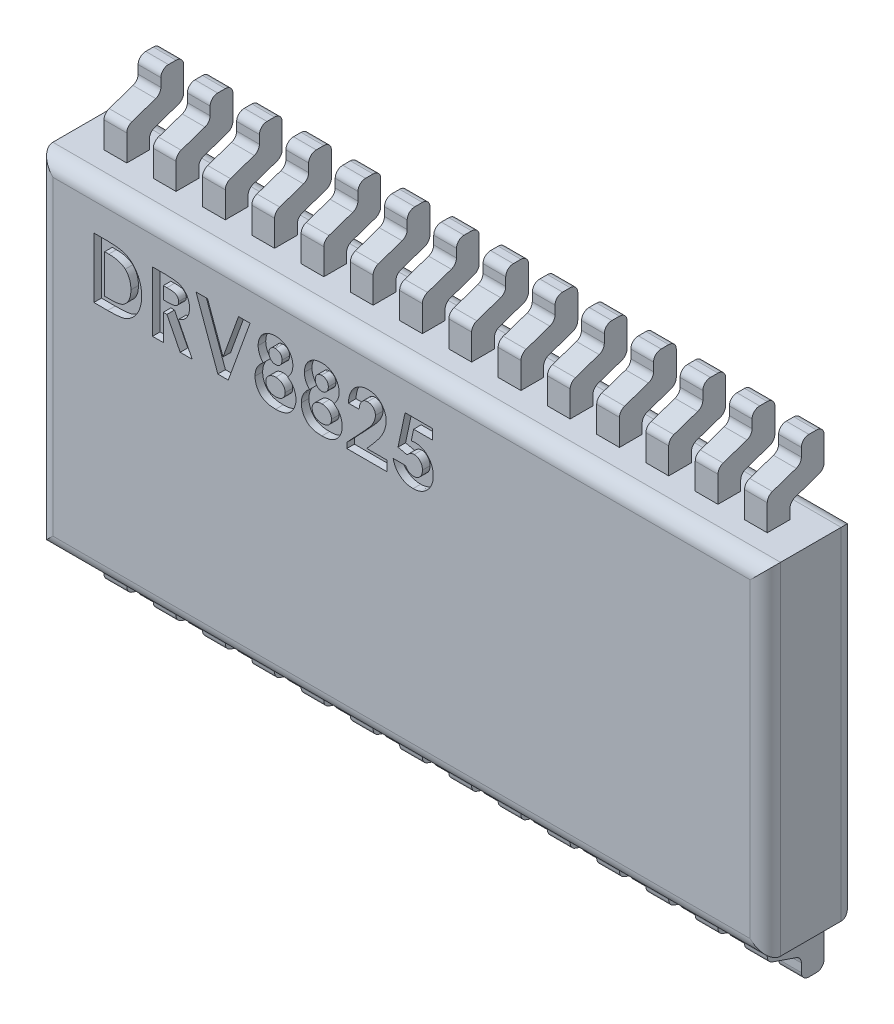
from build123d import *

# Parameters (mm, degrees)
SKETCH1_W           = 9.6
SKETCH1_H           = 4.5
BOSS_EXTRUDE1_DEPTH = 1.2
BOSS_EXTRUDE2_DEPTH = 0.3
LPATTERN1_COUNT     = 8
LPATTERN1_PITCH     = 0.65
LPATTERN1_COL_COUNT = 7
LPATTERN1_COL_PITCH = 0.65
FILLET1_R           = 0.2
CUT_EXTRUDE1_DEPTH  = 0.1


with BuildPart() as part:
    # Sketch1 → Boss-Extrude1 (new body)
    with BuildSketch(Plane.XY):
        Rectangle(SKETCH1_W, SKETCH1_H)
    extrude(amount=BOSS_EXTRUDE1_DEPTH)

    # Sketch2 → Boss-Extrude2 (add)
    with BuildSketch(Plane(origin=(0.175, 0, 0), x_dir=(0, 0, -1), z_dir=(1, 0, 0))):
        with BuildLine():
            Line((-0.75, 2.25), (-0.75, 2.593130895))
            ThreePointArc((-0.75, 2.593130895), (-0.731320668, 2.651328395), (-0.68226102, 2.687784086))
            Line((-0.68226102, 2.687784086), (-0.36773898, 2.794983873))
            ThreePointArc((-0.36773898, 2.794983873), (-0.318679332, 2.831439564), (-0.3, 2.889637064))
            Line((-0.3, 2.889637064), (-0.3, 3))
            ThreePointArc((-0.3, 3), (-0.270710678, 3.070710678), (-0.2, 3.1))
            Line((-0.2, 3.1), (-0.1, 3.1))
            ThreePointArc((-0.1, 3.1), (-0.029289322, 3.070710678), (0, 3))
            Line((0, 3), (0, 2.674940721))
            ThreePointArc((0, 2.674940721), (-0.018679332, 2.616743221), (-0.06773898, 2.58028753))
            Line((-0.06773898, 2.58028753), (-0.38226102, 2.473087743))
            ThreePointArc((-0.38226102, 2.473087743), (-0.431320668, 2.436632052), (-0.45, 2.378434552))
            Line((-0.45, 2.378434552), (-0.45, 2.25))
            Line((-0.45, 2.25), (-0.75, 2.25))
        make_face()
        with BuildLine():
            Line((-0.45, -2.25), (-0.75, -2.25))
            Line((-0.75, -2.25), (-0.75, -2.593130895))
            ThreePointArc((-0.75, -2.593130895), (-0.731320668, -2.651328395), (-0.68226102, -2.687784086))
            Line((-0.68226102, -2.687784086), (-0.36773898, -2.794983873))
            ThreePointArc((-0.36773898, -2.794983873), (-0.318679332, -2.831439564), (-0.3, -2.889637064))
            Line((-0.3, -2.889637064), (-0.3, -3))
            ThreePointArc((-0.3, -3), (-0.270710678, -3.070710678), (-0.2, -3.1))
            Line((-0.2, -3.1), (-0.1, -3.1))
            ThreePointArc((-0.1, -3.1), (-0.029289322, -3.070710678), (0, -3))
            Line((0, -3), (0, -2.674940721))
            ThreePointArc((0, -2.674940721), (-0.018679332, -2.616743221), (-0.06773898, -2.58028753))
            Line((-0.06773898, -2.58028753), (-0.38226102, -2.473087743))
            ThreePointArc((-0.38226102, -2.473087743), (-0.431320668, -2.436632052), (-0.45, -2.378434552))
            Line((-0.45, -2.378434552), (-0.45, -2.25))
        make_face()
    boss_extrude2 = extrude(amount=BOSS_EXTRUDE2_DEPTH)

    # LPattern1: Boss-Extrude2 ×8
    with Locations(*[(-i * LPATTERN1_PITCH, 0, 0) for i in range(1, LPATTERN1_COUNT)]):
        add(boss_extrude2)

    # LPattern1 col: Boss-Extrude2 ×7
    with Locations(*[(i * LPATTERN1_COL_PITCH, 0, 0) for i in range(1, LPATTERN1_COL_COUNT)]):
        add(boss_extrude2)

    # Fillet1
    fillet1_edges = [part.edges().sort_by_distance(p)[0] for p in [
        (-4.8, 0, 1.2),
        (0, -2.25, 1.2),
        (4.8, 0, 1.2),
        (0, -2.25, 0),
        (-4.8, 0, 0),
        (0, 2.25, 0),
        (4.8, 0, 0),
        (0, 2.25, 1.2),
    ]]
    fillet(fillet1_edges, radius=FILLET1_R)

    # Sketch3 → Cut-Extrude1 (cut)
    # profile 1 of 7: a face of its own
    with BuildSketch(Plane.XY.offset(1.2)):
        with BuildLine():
            Line((-4.059080057, 1.683178556), (-3.879564082, 1.683178556))
            add(Edge.make_bspline(
                [(-3.879564082, 1.683178556), (-3.865568747, 1.683080724), (-3.838515606, 1.682891613), (-3.799320956, 1.68076079), (-3.76287492, 1.677483736), (-3.729154003, 1.672975554), (-3.698227339, 1.667009994), (-3.670134806, 1.659527369), (-3.64478212, 1.650889922), (-3.621891294, 1.640726214), (-3.600994171, 1.62887634), (-3.581151686, 1.615676531), (-3.562402799, 1.600643241), (-3.544484399, 1.58406649), (-3.527627727, 1.565643014), (-3.511552059, 1.54567797), (-3.496651, 1.523881839), (-3.482474123, 1.500777224), (-3.469653024, 1.476266208), (-3.458469983, 1.450557424), (-3.449101881, 1.423816319), (-3.441489814, 1.396014393), (-3.435422117, 1.367243939), (-3.431176672, 1.337446903), (-3.428552096, 1.306650871), (-3.428285855, 1.285778888), (-3.42815057, 1.275173248)],
                knots=[0, 0, 0, 0, 1.44355588, 2.790409838, 4.047694926, 5.217575253, 6.298404546, 7.294384826, 8.214239204, 9.058592145, 9.873746385, 10.689560431, 11.514393297, 12.350027578, 13.205127629, 14.088021785, 14.991911688, 15.926770944, 16.882954281, 17.842803888, 18.816321264, 19.80318086, 20.814351908, 21.847355356, 22.906180909, 24, 24, 24, 24], degree=3))
            add(Edge.make_bspline(
                [(-3.42815057, 1.275173248), (-3.428504818, 1.260208), (-3.429202177, 1.230748033), (-3.435076336, 1.187515871), (-3.44457684, 1.146073532), (-3.457935412, 1.106745193), (-3.474496465, 1.069881081), (-3.494280497, 1.036131277), (-3.516997428, 1.005676933), (-3.542382605, 0.978669688), (-3.56986857, 0.955456594), (-3.598432029, 0.935576278), (-3.628351244, 0.919898991), (-3.654714254, 0.909957246), (-3.677574272, 0.90377434), (-3.697645121, 0.900120184), (-3.720443557, 0.896769102), (-3.746182156, 0.894179458), (-3.774748009, 0.891870132), (-3.80625498, 0.890615334), (-3.840601057, 0.889572783), (-3.864457655, 0.889477892), (-3.876861007, 0.889428556)],
                knots=[0, 0, 0, 0, 1.315458931, 2.589557908, 3.828601765, 5.048913369, 6.235739168, 7.376350998, 8.481830359, 9.569842114, 10.627874879, 11.640079404, 12.624025415, 13.590060155, 14.111227486, 14.704434459, 15.382649715, 16.137166398, 16.978595427, 17.902333227, 18.909396075, 20, 20, 20, 20], degree=3))
            Line((-3.876861007, 0.889428556), (-4.059080057, 0.889428556))
            Line((-4.059080057, 0.889428556), (-4.059080057, 1.683178556))
        make_face()
        with BuildLine():
            Line((-3.916612108, 1.540710607), (-3.916612108, 1.031896505))
            Line((-3.916612108, 1.031896505), (-3.842198046, 1.031896505))
            add(Edge.make_bspline(
                [(-3.842198046, 1.031896505), (-3.833343915, 1.031912729), (-3.816314475, 1.031943934), (-3.791727817, 1.033430255), (-3.768991393, 1.034922111), (-3.74816779, 1.037753703), (-3.729105461, 1.040907897), (-3.712066273, 1.045297391), (-3.696698973, 1.049908182), (-3.68319127, 1.05577829), (-3.670819315, 1.062385488), (-3.659364298, 1.070126587), (-3.648306999, 1.078722784), (-3.637854143, 1.088426908), (-3.62796617, 1.099110456), (-3.618701582, 1.110828477), (-3.609936722, 1.123545219), (-3.601896568, 1.137327918), (-3.594549431, 1.152031025), (-3.588031698, 1.16751212), (-3.582627535, 1.183900127), (-3.578135926, 1.201041634), (-3.574926162, 1.219085878), (-3.572270694, 1.237899208), (-3.570901723, 1.25755616), (-3.570713841, 1.270931406), (-3.570618519, 1.277717318)],
                knots=[0, 0, 0, 0, 1.50275155, 2.890291501, 4.180787663, 5.369391935, 6.45668281, 7.458360028, 8.354766181, 9.177074746, 9.954075863, 10.732690366, 11.5210699, 12.329727389, 13.151100085, 13.990027547, 14.863562427, 15.770965086, 16.696477834, 17.652329173, 18.619756807, 19.62365428, 20.657822005, 21.729286259, 22.847956731, 24, 24, 24, 24], degree=3))
            add(Edge.make_bspline(
                [(-3.570618519, 1.277717318), (-3.570808368, 1.288116087), (-3.571178559, 1.308392879), (-3.574748601, 1.33792647), (-3.580559949, 1.36573677), (-3.588852183, 1.391720568), (-3.5993048, 1.415950892), (-3.612388688, 1.43822246), (-3.627540765, 1.458909403), (-3.639522614, 1.471045027), (-3.645509594, 1.477108845)],
                knots=[0, 0, 0, 0, 1.13821349, 2.219428113, 3.251817212, 4.244760574, 5.201143372, 6.134805572, 7.068016741, 8, 8, 8, 8], degree=3))
            add(Edge.make_bspline(
                [(-3.645509594, 1.477108845), (-3.651413324, 1.482276037), (-3.663471024, 1.492829442), (-3.684640382, 1.505475121), (-3.707967918, 1.516585589), (-3.733987296, 1.525394951), (-3.762447051, 1.53236177), (-3.793516689, 1.537166615), (-3.827029826, 1.540254157), (-3.850246946, 1.540555198), (-3.862232601, 1.540710607)],
                knots=[0, 0, 0, 0, 0.813307809, 1.661089106, 2.549956539, 3.493439533, 4.508053171, 5.589449661, 6.755572447, 8, 8, 8, 8], degree=3))
            Line((-3.862232601, 1.540710607), (-3.916612108, 1.540710607))
        make_face(mode=Mode.SUBTRACT)
    # profile 2 of 7: a face of its own
    with BuildSketch(Plane.XY.offset(1.2)):
        with BuildLine():
            Line((-3.285682621, 1.683178556), (-3.11968202, 1.683178556))
            add(Edge.make_bspline(
                [(-3.11968202, 1.683178556), (-3.108709431, 1.68313961), (-3.087606051, 1.683064705), (-3.05717613, 1.681882904), (-3.029222063, 1.680238332), (-3.003702461, 1.67772867), (-2.980628242, 1.674401162), (-2.95997628, 1.670478581), (-2.941747179, 1.666007959), (-2.925787201, 1.660437211), (-2.911384111, 1.654153492), (-2.897958428, 1.646933383), (-2.885213962, 1.638857283), (-2.873235897, 1.629712688), (-2.86192014, 1.619664107), (-2.851245342, 1.608701424), (-2.84136235, 1.596731682), (-2.832332359, 1.583830513), (-2.824102248, 1.570258779), (-2.816828557, 1.555997846), (-2.810913579, 1.541037796), (-2.805687062, 1.525594835), (-2.801922571, 1.509448202), (-2.799304422, 1.492755088), (-2.797387517, 1.47545673), (-2.797277304, 1.463704994), (-2.797221083, 1.457710307)],
                knots=[0, 0, 0, 0, 1.749336639, 3.364467119, 4.854658419, 6.213483162, 7.451590619, 8.570285859, 9.5643256, 10.440900261, 11.26203566, 12.067320669, 12.869050712, 13.665104639, 14.467235401, 15.27997916, 16.102287765, 16.939272006, 17.78853747, 18.631303466, 19.488103222, 20.351255419, 21.228522269, 22.127379805, 23.044756219, 24, 24, 24, 24], degree=3))
            add(Edge.make_bspline(
                [(-2.797221083, 1.457710307), (-2.797367124, 1.451453231), (-2.797653485, 1.439184244), (-2.799195979, 1.421162103), (-2.802015173, 1.40391978), (-2.806285254, 1.387507756), (-2.811193156, 1.371721767), (-2.817719408, 1.356853073), (-2.825084928, 1.34268543), (-2.833832741, 1.329419245), (-2.843433038, 1.31675985), (-2.854597982, 1.305192273), (-2.866604255, 1.294094801), (-2.880126775, 1.284162541), (-2.894569455, 1.27472391), (-2.910219257, 1.266169998), (-2.926974045, 1.258285777), (-2.93875349, 1.25388899), (-2.944777173, 1.251640595)],
                knots=[0, 0, 0, 0, 1.099860209, 2.156625411, 3.176576793, 4.16617041, 5.135385252, 6.078461593, 7.016046972, 7.938469504, 8.868247731, 9.803980173, 10.76021508, 11.73834243, 12.748633912, 13.790971185, 14.870363756, 16, 16, 16, 16], degree=3))
            Line((-2.944777173, 1.251640595), (-2.761604096, 0.889428556))
            Line((-2.761604096, 0.889428556), (-2.919972485, 0.889428556))
            Line((-2.919972485, 0.889428556), (-3.094877333, 1.235422146))
            Line((-3.094877333, 1.235422146), (-3.143214673, 1.235422146))
            Line((-3.143214673, 1.235422146), (-3.143214673, 0.889428556))
            Line((-3.143214673, 0.889428556), (-3.285682621, 0.889428556))
            Line((-3.285682621, 0.889428556), (-3.285682621, 1.683178556))
        make_face()
        with BuildLine():
            Line((-3.143214673, 1.377890095), (-3.087722135, 1.377890095))
            add(Edge.make_bspline(
                [(-3.087722135, 1.377890095), (-3.08093771, 1.377966505), (-3.067946996, 1.378112816), (-3.049264643, 1.378791463), (-3.03229661, 1.380426667), (-3.016970033, 1.382492686), (-3.003207787, 1.384878204), (-2.991132629, 1.388296796), (-2.980558498, 1.391959904), (-2.971610698, 1.396512197), (-2.963965904, 1.401689141), (-2.957365113, 1.407570279), (-2.951905312, 1.414376946), (-2.947411618, 1.421924168), (-2.943916012, 1.430278698), (-2.941364488, 1.439348822), (-2.939938563, 1.44923786), (-2.939774506, 1.456062642), (-2.939689032, 1.45961836)],
                knots=[0, 0, 0, 0, 1.688639943, 3.233382647, 4.650958383, 5.928841754, 7.082724185, 8.122798841, 9.049171256, 9.863274652, 10.613301712, 11.341792392, 12.054588806, 12.776240173, 13.521029143, 14.301969904, 15.115324896, 16, 16, 16, 16], degree=3))
            add(Edge.make_bspline(
                [(-2.939689032, 1.45961836), (-2.939850628, 1.463825033), (-2.940168055, 1.472088264), (-2.943317913, 1.483984418), (-2.948331806, 1.494995123), (-2.955204481, 1.505070629), (-2.963859721, 1.513903513), (-2.973792292, 1.521689771), (-2.985216563, 1.527846561), (-2.995794578, 1.531907514), (-3.005418099, 1.534337224), (-3.014103023, 1.536147822), (-3.024160218, 1.537431046), (-3.035597275, 1.538792132), (-3.048385042, 1.539674728), (-3.06259322, 1.540318847), (-3.078181002, 1.540582388), (-3.089047167, 1.540666637), (-3.094718328, 1.540710607)],
                knots=[0, 0, 0, 0, 1.020303359, 2.004196876, 2.966617323, 3.9489082, 4.950758222, 5.960522915, 7.003732012, 8.091992268, 8.70421221, 9.413913587, 10.24622431, 11.166358409, 12.212345909, 13.359657661, 14.621978493, 16, 16, 16, 16], degree=3))
            Line((-3.094718328, 1.540710607), (-3.143214673, 1.540710607))
            Line((-3.143214673, 1.540710607), (-3.143214673, 1.377890095))
        make_face(mode=Mode.SUBTRACT)
    # profile 3 of 7: a face of its own
    with BuildSketch(Plane.XY.offset(1.2)):
        Polygon((-2.710722685, 1.683178556), (-2.558555468, 1.683178556), (-2.354552814, 1.119348929), (-2.150073146, 1.683178556), (-1.998382942, 1.683178556), (-2.286180919, 0.889428556), (-2.423401722, 0.889428556), align=None)
    # profile 4 of 7: a face of its own
    with BuildSketch(Plane.XY.offset(1.2)):
        with BuildLine():
            add(Edge.make_bspline(
                [(-1.501653174, 1.316832402), (-1.493329706, 1.310885059), (-1.476854151, 1.29911283), (-1.455095969, 1.278022441), (-1.43635459, 1.254495868), (-1.420826816, 1.228677418), (-1.408386433, 1.201201714), (-1.399481006, 1.17236244), (-1.393824381, 1.142413965), (-1.393206508, 1.122024208), (-1.39289416, 1.111716717)],
                knots=[0, 0, 0, 0, 1.013736912, 2.006600758, 2.994453809, 3.989973287, 4.987781207, 5.978959008, 6.978317308, 8, 8, 8, 8], degree=3))
            add(Edge.make_bspline(
                [(-1.39289416, 1.111716717), (-1.393270985, 1.100555519), (-1.394018368, 1.078418714), (-1.40062624, 1.045955093), (-1.411234913, 1.014766916), (-1.425733734, 0.985198421), (-1.443912589, 0.958168485), (-1.465101736, 0.934239288), (-1.489327885, 0.914035783), (-1.511883115, 0.900327835), (-1.53129719, 0.891221904), (-1.546964179, 0.885394291), (-1.563507488, 0.880263894), (-1.58104517, 0.876165046), (-1.599574035, 0.872965223), (-1.61906764, 0.870852066), (-1.639538818, 0.86931593), (-1.653499296, 0.86915732), (-1.660657581, 0.869075992)],
                knots=[0, 0, 0, 0, 1.313679292, 2.605514271, 3.884962679, 5.186178731, 6.472827995, 7.711026938, 8.938935107, 10.174644318, 10.808706728, 11.462743532, 12.142127587, 12.847854939, 13.582806024, 14.355735269, 15.156897313, 16, 16, 16, 16], degree=3))
            add(Edge.make_bspline(
                [(-1.660657581, 0.869075992), (-1.668291183, 0.869179539), (-1.683198101, 0.869381745), (-1.704958881, 0.870604388), (-1.725485725, 0.87285847), (-1.744821692, 0.875825793), (-1.762948178, 0.879752422), (-1.779865721, 0.884731173), (-1.795615169, 0.890400034), (-1.814893321, 0.899031362), (-1.836924753, 0.912511029), (-1.860736746, 0.932251613), (-1.881637584, 0.955763265), (-1.899808883, 0.982386017), (-1.914132186, 1.011956085), (-1.924783421, 1.043545362), (-1.931091209, 1.077068244), (-1.931850596, 1.10002977), (-1.932237108, 1.111716717)],
                knots=[0, 0, 0, 0, 0.886964665, 1.7320671, 2.531131818, 3.285397207, 4.004107883, 4.684213108, 5.332925796, 5.947568694, 7.135706876, 8.320776993, 9.52873045, 10.778999824, 12.05415135, 13.333578234, 14.642845846, 16, 16, 16, 16], degree=3))
            add(Edge.make_bspline(
                [(-1.932237108, 1.111716717), (-1.931883901, 1.121911656), (-1.931189805, 1.141945945), (-1.926217903, 1.171302515), (-1.917692602, 1.199136017), (-1.905994562, 1.225640216), (-1.890910138, 1.250818062), (-1.87235013, 1.274484295), (-1.85054986, 1.296852417), (-1.834018307, 1.310061936), (-1.825545151, 1.316832402)],
                knots=[0, 0, 0, 0, 1.01821053, 2.000906977, 2.963938143, 3.919209931, 4.888045165, 5.887808425, 6.917407893, 8, 8, 8, 8], degree=3))
            add(Edge.make_bspline(
                [(-1.825545151, 1.316832402), (-1.830798059, 1.322890862), (-1.841139451, 1.334818145), (-1.854521314, 1.354014156), (-1.86579497, 1.373805264), (-1.875366841, 1.394030853), (-1.882442612, 1.415039158), (-1.887793526, 1.436499884), (-1.890819998, 1.458631667), (-1.891293045, 1.473549147), (-1.89153198, 1.481083955)],
                knots=[0, 0, 0, 0, 1.061529281, 2.089831458, 3.092927091, 4.075998741, 5.048384512, 6.024008542, 7.00192825, 8, 8, 8, 8], degree=3))
            add(Edge.make_bspline(
                [(-1.89153198, 1.481083955), (-1.891215188, 1.491283863), (-1.890590169, 1.511407889), (-1.885054415, 1.540833965), (-1.875863719, 1.568794603), (-1.863360559, 1.595207938), (-1.847483489, 1.619498318), (-1.828618093, 1.64128136), (-1.806499159, 1.659759158), (-1.781949233, 1.675613924), (-1.754845257, 1.688224658), (-1.725444393, 1.697048705), (-1.694101658, 1.702634792), (-1.672501182, 1.703227799), (-1.661452603, 1.70353112)],
                knots=[0, 0, 0, 0, 1.022455555, 2.017265428, 2.990720743, 3.968117071, 4.939886797, 5.893155559, 6.847550415, 7.820889576, 8.817530429, 9.83499769, 10.892607882, 12, 12, 12, 12], degree=3))
            add(Edge.make_bspline(
                [(-1.661452603, 1.70353112), (-1.650563153, 1.703227303), (-1.629331006, 1.702634922), (-1.598539078, 1.697085848), (-1.569773572, 1.688065244), (-1.543272357, 1.675188241), (-1.518976324, 1.659302916), (-1.497233319, 1.640181739), (-1.478427123, 1.617856155), (-1.462418263, 1.59293739), (-1.449661661, 1.56609103), (-1.440230751, 1.537937049), (-1.434775801, 1.508696739), (-1.433993027, 1.488843948), (-1.433599288, 1.478857893)],
                knots=[0, 0, 0, 0, 1.094655142, 2.134348324, 3.136019022, 4.118575226, 5.088726318, 6.048298823, 7.020513804, 8.015920439, 9.020015034, 10.003048569, 10.995523219, 12, 12, 12, 12], degree=3))
            add(Edge.make_bspline(
                [(-1.433599288, 1.478857893), (-1.433788962, 1.471800289), (-1.434161182, 1.457950269), (-1.436913305, 1.437545281), (-1.441547543, 1.417966668), (-1.44800872, 1.398741295), (-1.456991962, 1.379346701), (-1.469148376, 1.35941125), (-1.483935058, 1.338106622), (-1.495547778, 1.324163178), (-1.501653174, 1.316832402)],
                knots=[0, 0, 0, 0, 0.940746401, 1.846144481, 2.739104268, 3.619506754, 4.545839139, 5.581956076, 6.728711598, 8, 8, 8, 8], degree=3))
        make_face()
        with BuildLine():
            add(Edge.make_bspline(
                [(-1.6649507, 1.561063172), (-1.670816403, 1.56078039), (-1.682226491, 1.560230319), (-1.698507351, 1.555265311), (-1.713144375, 1.547144688), (-1.725803445, 1.535969113), (-1.736184542, 1.522409226), (-1.743814078, 1.506819365), (-1.748338483, 1.489391927), (-1.748817479, 1.477188905), (-1.749064032, 1.470907673)],
                knots=[0, 0, 0, 0, 1.018099191, 1.980427864, 2.929421084, 3.909248076, 4.895556904, 5.880788387, 6.909183412, 8, 8, 8, 8], degree=3))
            add(Edge.make_bspline(
                [(-1.749064032, 1.470907673), (-1.748759464, 1.464572798), (-1.748164766, 1.452203344), (-1.743488134, 1.434441068), (-1.735516686, 1.418343395), (-1.724571943, 1.404246552), (-1.711272307, 1.392732658), (-1.696380791, 1.383938987), (-1.679732247, 1.378918908), (-1.668163106, 1.378238168), (-1.662247625, 1.377890095)],
                knots=[0, 0, 0, 0, 1.07118507, 2.091592095, 3.082435519, 4.092579768, 5.090825648, 6.043203473, 6.999459622, 8, 8, 8, 8], degree=3))
            add(Edge.make_bspline(
                [(-1.662247625, 1.377890095), (-1.656220309, 1.378159792), (-1.644477967, 1.378685212), (-1.627787853, 1.383835548), (-1.612752194, 1.392072461), (-1.599876373, 1.403717633), (-1.589211238, 1.417819581), (-1.581444066, 1.434198575), (-1.576973563, 1.452546875), (-1.576376735, 1.465370653), (-1.576067237, 1.472020704)],
                knots=[0, 0, 0, 0, 1.008803858, 1.965339183, 2.900766489, 3.864508618, 4.855158575, 5.849593072, 6.884859315, 8, 8, 8, 8], degree=3))
            add(Edge.make_bspline(
                [(-1.576067237, 1.472020704), (-1.576384564, 1.478297783), (-1.576998264, 1.490437434), (-1.581398727, 1.507866003), (-1.589480396, 1.523212543), (-1.600098668, 1.536688226), (-1.613411135, 1.547555525), (-1.628865934, 1.555547403), (-1.646349262, 1.56018277), (-1.658615949, 1.560763349), (-1.6649507, 1.561063172)],
                knots=[0, 0, 0, 0, 1.065910571, 2.061433587, 3.023559535, 3.990682701, 4.956464619, 5.918590567, 6.925120432, 8, 8, 8, 8], degree=3))
        make_face(mode=Mode.SUBTRACT)
        with BuildLine():
            add(Edge.make_bspline(
                [(-1.660339572, 1.235422146), (-1.664797063, 1.235348123), (-1.67358272, 1.235202224), (-1.686498359, 1.23351979), (-1.698892241, 1.231012548), (-1.710748991, 1.227553879), (-1.722008709, 1.222838842), (-1.73276684, 1.217154777), (-1.742986229, 1.210444227), (-1.752515296, 1.202829021), (-1.761127346, 1.194470606), (-1.768890325, 1.185753051), (-1.775235464, 1.176450983), (-1.780519453, 1.166873605), (-1.784765168, 1.156945022), (-1.787571906, 1.14650173), (-1.789379052, 1.135682806), (-1.789638359, 1.128313393), (-1.78976916, 1.124596074)],
                knots=[0, 0, 0, 0, 1.129580664, 2.226389355, 3.296443603, 4.333934503, 5.352185725, 6.386189251, 7.41493955, 8.447544828, 9.47401038, 10.455044306, 11.4018853, 12.322125673, 13.225630306, 14.132028716, 15.057747923, 16, 16, 16, 16], degree=3))
            add(Edge.make_bspline(
                [(-1.78976916, 1.124596074), (-1.789706818, 1.120719278), (-1.78958317, 1.113030132), (-1.787715646, 1.101807203), (-1.785026741, 1.090983458), (-1.781250088, 1.080660215), (-1.776199532, 1.070843484), (-1.770169076, 1.061437824), (-1.762948442, 1.052509191), (-1.754733413, 1.044105455), (-1.745536725, 1.036523785), (-1.735624711, 1.029844202), (-1.725128286, 1.02395514), (-1.713732354, 1.019713604), (-1.701858953, 1.015831378), (-1.68918999, 1.013476124), (-1.675863839, 1.011743064), (-1.666759055, 1.011611453), (-1.662088621, 1.011543941)],
                knots=[0, 0, 0, 0, 0.973817353, 1.931446211, 2.852767904, 3.776304432, 4.688323523, 5.623710549, 6.581246645, 7.570897993, 8.57436511, 9.572506873, 10.574556662, 11.591826551, 12.624694332, 13.712108235, 14.826391851, 16, 16, 16, 16], degree=3))
            add(Edge.make_bspline(
                [(-1.662088621, 1.011543941), (-1.657367506, 1.011629517), (-1.64816755, 1.011796277), (-1.634719063, 1.013270121), (-1.621999181, 1.015608682), (-1.610023097, 1.018953369), (-1.598745524, 1.023238047), (-1.588317741, 1.028691594), (-1.578501663, 1.03487198), (-1.569612733, 1.04209252), (-1.561496483, 1.049961401), (-1.554503195, 1.058585025), (-1.54855688, 1.067686088), (-1.543760528, 1.077362927), (-1.539890304, 1.087569863), (-1.537235572, 1.09840867), (-1.535588216, 1.109757546), (-1.535438287, 1.117488118), (-1.535362108, 1.121415986)],
                knots=[0, 0, 0, 0, 1.200705402, 2.339794563, 3.437264955, 4.487414319, 5.499029866, 6.500076882, 7.476298407, 8.444948224, 9.407950986, 10.347155707, 11.263432813, 12.167927724, 13.089546445, 14.03463663, 15.00140776, 16, 16, 16, 16], degree=3))
            add(Edge.make_bspline(
                [(-1.535362108, 1.121415986), (-1.535507564, 1.125395206), (-1.53579188, 1.133173202), (-1.537347612, 1.144659242), (-1.540266007, 1.155548187), (-1.544084121, 1.166092581), (-1.549163089, 1.176074222), (-1.555468517, 1.185472047), (-1.562645642, 1.194518849), (-1.571034116, 1.202811899), (-1.580205607, 1.210394694), (-1.589967198, 1.217150132), (-1.600288822, 1.222871365), (-1.611198711, 1.227548188), (-1.622736728, 1.231014348), (-1.634814837, 1.233519702), (-1.647413225, 1.2352026), (-1.655987931, 1.235348236), (-1.660339572, 1.235422146)],
                knots=[0, 0, 0, 0, 1.011708178, 1.977538892, 2.938094892, 3.871441737, 4.823268678, 5.775953079, 6.743660653, 7.753304209, 8.767430709, 9.76505158, 10.765940967, 11.761741361, 12.775867861, 13.822051386, 14.89469657, 16, 16, 16, 16], degree=3))
        make_face(mode=Mode.SUBTRACT)
    # profile 5 of 7: a face of its own
    with BuildSketch(Plane.XY.offset(1.2)):
        with BuildLine():
            add(Edge.make_bspline(
                [(-0.891076251, 1.316832402), (-0.882752783, 1.310885059), (-0.866277228, 1.29911283), (-0.844519046, 1.278022441), (-0.825777667, 1.254495868), (-0.810249893, 1.228677418), (-0.79780951, 1.201201714), (-0.788904083, 1.17236244), (-0.783247458, 1.142413965), (-0.782629585, 1.122024208), (-0.782317237, 1.111716717)],
                knots=[0, 0, 0, 0, 1.013736912, 2.006600758, 2.994453809, 3.989973287, 4.987781207, 5.978959008, 6.978317308, 8, 8, 8, 8], degree=3))
            add(Edge.make_bspline(
                [(-0.782317237, 1.111716717), (-0.782694062, 1.100555519), (-0.783441445, 1.078418714), (-0.790049317, 1.045955093), (-0.80065799, 1.014766916), (-0.815156811, 0.985198421), (-0.833335666, 0.958168485), (-0.854524813, 0.934239288), (-0.878750962, 0.914035783), (-0.901306192, 0.900327835), (-0.920720267, 0.891221904), (-0.936387255, 0.885394291), (-0.952930565, 0.880263894), (-0.970468247, 0.876165046), (-0.988997112, 0.872965223), (-1.008490717, 0.870852066), (-1.028961895, 0.86931593), (-1.042922373, 0.86915732), (-1.050080658, 0.869075992)],
                knots=[0, 0, 0, 0, 1.313679292, 2.605514271, 3.884962679, 5.186178731, 6.472827995, 7.711026938, 8.938935107, 10.174644318, 10.808706728, 11.462743532, 12.142127587, 12.847854939, 13.582806024, 14.355735269, 15.156897313, 16, 16, 16, 16], degree=3))
            add(Edge.make_bspline(
                [(-1.050080658, 0.869075992), (-1.057714259, 0.869179539), (-1.072621178, 0.869381745), (-1.094381958, 0.870604388), (-1.114908802, 0.87285847), (-1.134244769, 0.875825793), (-1.152371255, 0.879752422), (-1.169288798, 0.884731173), (-1.185038246, 0.890400034), (-1.204316398, 0.899031362), (-1.22634783, 0.912511029), (-1.250159823, 0.932251613), (-1.271060661, 0.955763265), (-1.28923196, 0.982386017), (-1.303555263, 1.011956085), (-1.314206498, 1.043545362), (-1.320514286, 1.077068244), (-1.321273673, 1.10002977), (-1.321660185, 1.111716717)],
                knots=[0, 0, 0, 0, 0.886964665, 1.7320671, 2.531131818, 3.285397207, 4.004107883, 4.684213108, 5.332925796, 5.947568694, 7.135706876, 8.320776993, 9.52873045, 10.778999824, 12.05415135, 13.333578234, 14.642845846, 16, 16, 16, 16], degree=3))
            add(Edge.make_bspline(
                [(-1.321660185, 1.111716717), (-1.321306978, 1.121911656), (-1.320612882, 1.141945945), (-1.31564098, 1.171302515), (-1.307115679, 1.199136017), (-1.295417639, 1.225640216), (-1.280333215, 1.250818062), (-1.261773207, 1.274484295), (-1.239972937, 1.296852417), (-1.223441384, 1.310061936), (-1.214968228, 1.316832402)],
                knots=[0, 0, 0, 0, 1.01821053, 2.000906977, 2.963938143, 3.919209931, 4.888045165, 5.887808425, 6.917407893, 8, 8, 8, 8], degree=3))
            add(Edge.make_bspline(
                [(-1.214968228, 1.316832402), (-1.220221135, 1.322890862), (-1.230562528, 1.334818145), (-1.243944391, 1.354014156), (-1.255218047, 1.373805264), (-1.264789918, 1.394030853), (-1.271865689, 1.415039158), (-1.277216603, 1.436499884), (-1.280243075, 1.458631667), (-1.280716122, 1.473549147), (-1.280955057, 1.481083955)],
                knots=[0, 0, 0, 0, 1.061529281, 2.089831458, 3.092927091, 4.075998741, 5.048384512, 6.024008542, 7.00192825, 8, 8, 8, 8], degree=3))
            add(Edge.make_bspline(
                [(-1.280955057, 1.481083955), (-1.280638265, 1.491283863), (-1.280013246, 1.511407889), (-1.274477492, 1.540833965), (-1.265286796, 1.568794603), (-1.252783636, 1.595207938), (-1.236906566, 1.619498318), (-1.21804117, 1.64128136), (-1.195922236, 1.659759158), (-1.17137231, 1.675613924), (-1.144268334, 1.688224658), (-1.11486747, 1.697048705), (-1.083524735, 1.702634792), (-1.061924259, 1.703227799), (-1.05087568, 1.70353112)],
                knots=[0, 0, 0, 0, 1.022455555, 2.017265428, 2.990720743, 3.968117071, 4.939886797, 5.893155559, 6.847550415, 7.820889576, 8.817530429, 9.83499769, 10.892607882, 12, 12, 12, 12], degree=3))
            add(Edge.make_bspline(
                [(-1.05087568, 1.70353112), (-1.03998623, 1.703227303), (-1.018754083, 1.702634922), (-0.987962155, 1.697085848), (-0.959196649, 1.688065244), (-0.932695433, 1.675188241), (-0.908399401, 1.659302916), (-0.886656396, 1.640181739), (-0.867850199, 1.617856155), (-0.85184134, 1.59293739), (-0.839084738, 1.56609103), (-0.829653828, 1.537937049), (-0.824198878, 1.508696739), (-0.823416104, 1.488843948), (-0.823022365, 1.478857893)],
                knots=[0, 0, 0, 0, 1.094655142, 2.134348324, 3.136019022, 4.118575226, 5.088726318, 6.048298823, 7.020513804, 8.015920439, 9.020015034, 10.003048569, 10.995523219, 12, 12, 12, 12], degree=3))
            add(Edge.make_bspline(
                [(-0.823022365, 1.478857893), (-0.823212039, 1.471800289), (-0.823584259, 1.457950269), (-0.826336382, 1.437545281), (-0.83097062, 1.417966668), (-0.837431797, 1.398741295), (-0.846415039, 1.379346701), (-0.858571453, 1.35941125), (-0.873358135, 1.338106622), (-0.884970855, 1.324163178), (-0.891076251, 1.316832402)],
                knots=[0, 0, 0, 0, 0.940746401, 1.846144481, 2.739104268, 3.619506754, 4.545839139, 5.581956076, 6.728711598, 8, 8, 8, 8], degree=3))
        make_face()
        with BuildLine():
            add(Edge.make_bspline(
                [(-1.054373777, 1.561063172), (-1.06023948, 1.56078039), (-1.071649568, 1.560230319), (-1.087930428, 1.555265311), (-1.102567452, 1.547144688), (-1.115226522, 1.535969113), (-1.125607619, 1.522409226), (-1.133237155, 1.506819365), (-1.13776156, 1.489391927), (-1.138240556, 1.477188905), (-1.138487108, 1.470907673)],
                knots=[0, 0, 0, 0, 1.018099191, 1.980427864, 2.929421084, 3.909248076, 4.895556904, 5.880788387, 6.909183412, 8, 8, 8, 8], degree=3))
            add(Edge.make_bspline(
                [(-1.138487108, 1.470907673), (-1.138182541, 1.464572798), (-1.137587843, 1.452203344), (-1.132911211, 1.434441068), (-1.124939763, 1.418343395), (-1.11399502, 1.404246552), (-1.100695383, 1.392732658), (-1.085803868, 1.383938987), (-1.069155324, 1.378918908), (-1.057586183, 1.378238168), (-1.051670702, 1.377890095)],
                knots=[0, 0, 0, 0, 1.07118507, 2.091592095, 3.082435519, 4.092579768, 5.090825648, 6.043203473, 6.999459622, 8, 8, 8, 8], degree=3))
            add(Edge.make_bspline(
                [(-1.051670702, 1.377890095), (-1.045643386, 1.378159792), (-1.033901044, 1.378685212), (-1.01721093, 1.383835548), (-1.002175271, 1.392072461), (-0.98929945, 1.403717633), (-0.978634315, 1.417819581), (-0.970867143, 1.434198575), (-0.96639664, 1.452546875), (-0.965799812, 1.465370653), (-0.965490314, 1.472020704)],
                knots=[0, 0, 0, 0, 1.008803858, 1.965339183, 2.900766489, 3.864508618, 4.855158575, 5.849593072, 6.884859315, 8, 8, 8, 8], degree=3))
            add(Edge.make_bspline(
                [(-0.965490314, 1.472020704), (-0.965807641, 1.478297783), (-0.966421341, 1.490437434), (-0.970821803, 1.507866003), (-0.978903473, 1.523212543), (-0.989521745, 1.536688226), (-1.002834212, 1.547555525), (-1.018289011, 1.555547403), (-1.035772339, 1.56018277), (-1.048039026, 1.560763349), (-1.054373777, 1.561063172)],
                knots=[0, 0, 0, 0, 1.065910571, 2.061433587, 3.023559535, 3.990682701, 4.956464619, 5.918590567, 6.925120432, 8, 8, 8, 8], degree=3))
        make_face(mode=Mode.SUBTRACT)
        with BuildLine():
            add(Edge.make_bspline(
                [(-1.049762649, 1.235422146), (-1.05422014, 1.235348123), (-1.063005797, 1.235202224), (-1.075921436, 1.23351979), (-1.088315318, 1.231012548), (-1.100172068, 1.227553879), (-1.111431786, 1.222838842), (-1.122189917, 1.217154777), (-1.132409306, 1.210444227), (-1.141938373, 1.202829021), (-1.150550422, 1.194470606), (-1.158313402, 1.185753051), (-1.164658541, 1.176450983), (-1.16994253, 1.166873605), (-1.174188244, 1.156945022), (-1.176994983, 1.14650173), (-1.178802129, 1.135682806), (-1.179061436, 1.128313393), (-1.179192237, 1.124596074)],
                knots=[0, 0, 0, 0, 1.129580664, 2.226389355, 3.296443603, 4.333934503, 5.352185725, 6.386189251, 7.41493955, 8.447544828, 9.47401038, 10.455044306, 11.4018853, 12.322125673, 13.225630306, 14.132028716, 15.057747923, 16, 16, 16, 16], degree=3))
            add(Edge.make_bspline(
                [(-1.179192237, 1.124596074), (-1.179129895, 1.120719278), (-1.179006247, 1.113030132), (-1.177138723, 1.101807203), (-1.174449818, 1.090983458), (-1.170673165, 1.080660215), (-1.165622609, 1.070843484), (-1.159592153, 1.061437824), (-1.152371519, 1.052509191), (-1.14415649, 1.044105455), (-1.134959802, 1.036523785), (-1.125047788, 1.029844202), (-1.114551363, 1.02395514), (-1.103155431, 1.019713604), (-1.09128203, 1.015831378), (-1.078613067, 1.013476124), (-1.065286916, 1.011743064), (-1.056182132, 1.011611453), (-1.051511698, 1.011543941)],
                knots=[0, 0, 0, 0, 0.973817353, 1.931446211, 2.852767904, 3.776304432, 4.688323523, 5.623710549, 6.581246645, 7.570897993, 8.57436511, 9.572506873, 10.574556662, 11.591826551, 12.624694332, 13.712108235, 14.826391851, 16, 16, 16, 16], degree=3))
            add(Edge.make_bspline(
                [(-1.051511698, 1.011543941), (-1.046790583, 1.011629517), (-1.037590626, 1.011796277), (-1.02414214, 1.013270121), (-1.011422258, 1.015608682), (-0.999446174, 1.018953369), (-0.988168601, 1.023238047), (-0.977740818, 1.028691594), (-0.96792474, 1.03487198), (-0.959035809, 1.04209252), (-0.95091956, 1.049961401), (-0.943926272, 1.058585025), (-0.937979957, 1.067686088), (-0.933183605, 1.077362927), (-0.929313381, 1.087569863), (-0.926658649, 1.09840867), (-0.925011293, 1.109757546), (-0.924861364, 1.117488118), (-0.924785185, 1.121415986)],
                knots=[0, 0, 0, 0, 1.200705402, 2.339794563, 3.437264955, 4.487414319, 5.499029866, 6.500076882, 7.476298407, 8.444948224, 9.407950986, 10.347155707, 11.263432813, 12.167927724, 13.089546445, 14.03463663, 15.00140776, 16, 16, 16, 16], degree=3))
            add(Edge.make_bspline(
                [(-0.924785185, 1.121415986), (-0.924930641, 1.125395206), (-0.925214957, 1.133173202), (-0.926770689, 1.144659242), (-0.929689084, 1.155548187), (-0.933507198, 1.166092581), (-0.938586165, 1.176074222), (-0.944891594, 1.185472047), (-0.952068719, 1.194518849), (-0.960457193, 1.202811899), (-0.969628684, 1.210394694), (-0.979390275, 1.217150132), (-0.989711899, 1.222871365), (-1.000621788, 1.227548188), (-1.012159805, 1.231014348), (-1.024237914, 1.233519702), (-1.036836302, 1.2352026), (-1.045411008, 1.235348236), (-1.049762649, 1.235422146)],
                knots=[0, 0, 0, 0, 1.011708178, 1.977538892, 2.938094892, 3.871441737, 4.823268678, 5.775953079, 6.743660653, 7.753304209, 8.767430709, 9.76505158, 10.765940967, 11.761741361, 12.775867861, 13.822051386, 14.89469657, 16, 16, 16, 16], degree=3))
        make_face(mode=Mode.SUBTRACT)
    # profile 6 of 7: a face of its own
    with BuildSketch(Plane.XY.offset(1.2)):
        with BuildLine():
            Line((-0.558439032, 1.418595223), (-0.70090698, 1.418595223))
            add(Edge.make_bspline(
                [(-0.70090698, 1.418595223), (-0.700291683, 1.429372169), (-0.699089429, 1.450429676), (-0.694307167, 1.481016379), (-0.687899101, 1.509917449), (-0.679346685, 1.537031789), (-0.668600015, 1.562349544), (-0.65593563, 1.585957026), (-0.641029984, 1.60772994), (-0.624200319, 1.627563284), (-0.605732355, 1.64535596), (-0.586009505, 1.661132065), (-0.564730083, 1.674150109), (-0.54228288, 1.684862755), (-0.51867172, 1.693421661), (-0.493673202, 1.699143982), (-0.467503778, 1.703019194), (-0.449588688, 1.70335829), (-0.440457762, 1.70353112)],
                knots=[0, 0, 0, 0, 1.199038563, 2.342849363, 3.436047546, 4.486744587, 5.497670872, 6.488682221, 7.459191391, 8.424610317, 9.374430501, 10.305433194, 11.225809216, 12.140057399, 13.06607119, 14.010487599, 14.985989317, 16, 16, 16, 16], degree=3))
            add(Edge.make_bspline(
                [(-0.440457762, 1.70353112), (-0.429249678, 1.703181399), (-0.407368873, 1.70249866), (-0.375574328, 1.696674671), (-0.345881699, 1.68693315), (-0.31831257, 1.673321677), (-0.293101641, 1.656029726), (-0.270253095, 1.635411905), (-0.250457906, 1.611035641), (-0.233590568, 1.58391519), (-0.219575827, 1.55519845), (-0.209754879, 1.525504149), (-0.203299676, 1.495620255), (-0.202611189, 1.475497953), (-0.20226916, 1.465501523)],
                knots=[0, 0, 0, 0, 1.075374347, 2.099382735, 3.09057751, 4.06680945, 5.040638231, 6.016817125, 7.011024321, 8.044445721, 9.0776792, 10.070479129, 11.0414456, 12, 12, 12, 12], degree=3))
            add(Edge.make_bspline(
                [(-0.20226916, 1.465501523), (-0.202402328, 1.459454975), (-0.202670362, 1.447284769), (-0.204534042, 1.428868259), (-0.20732993, 1.410108891), (-0.211545448, 1.391022748), (-0.216802544, 1.371604482), (-0.223180162, 1.351795978), (-0.230826236, 1.331709546), (-0.239613169, 1.311119114), (-0.250096002, 1.289957834), (-0.262301804, 1.26790849), (-0.276554545, 1.244990643), (-0.29268207, 1.221074889), (-0.310762705, 1.196198948), (-0.330884715, 1.170437754), (-0.352816342, 1.143700532), (-0.368381834, 1.1258282), (-0.376378985, 1.116645854)],
                knots=[0, 0, 0, 0, 0.728284026, 1.46585585, 2.227944881, 3.01186502, 3.81876927, 4.650621989, 5.517437689, 6.406905708, 7.346299482, 8.360816762, 9.441613733, 10.596154504, 11.834900912, 13.145207542, 14.533280747, 16, 16, 16, 16], degree=3))
            Line((-0.376378985, 1.116645854), (-0.459220282, 1.021720223))
            Line((-0.459220282, 1.021720223), (-0.192092878, 1.021720223))
            Line((-0.192092878, 1.021720223), (-0.192092878, 0.889428556))
            Line((-0.192092878, 0.889428556), (-0.721259544, 0.889428556))
            Line((-0.721259544, 0.889428556), (-0.721259544, 0.961616557))
            Line((-0.721259544, 0.961616557), (-0.486251031, 1.211730489))
            add(Edge.make_bspline(
                [(-0.486251031, 1.211730489), (-0.47944693, 1.21902639), (-0.466269406, 1.233156387), (-0.447519146, 1.253907791), (-0.430551817, 1.273600377), (-0.415719251, 1.292443833), (-0.402243053, 1.309826953), (-0.390724126, 1.326273687), (-0.381057081, 1.34163535), (-0.370562132, 1.360158832), (-0.360595381, 1.382251381), (-0.351450283, 1.407702903), (-0.345875714, 1.432028696), (-0.345106247, 1.447879906), (-0.344737108, 1.455484245)],
                knots=[0, 0, 0, 0, 1.246127091, 2.413378631, 3.493388633, 4.492180848, 5.408488754, 6.240484944, 6.999099869, 7.674939598, 8.898438119, 10.020720584, 11.050475521, 12, 12, 12, 12], degree=3))
            add(Edge.make_bspline(
                [(-0.344737108, 1.455484245), (-0.345013104, 1.462840857), (-0.34554789, 1.477095471), (-0.351424755, 1.497372583), (-0.360529397, 1.515731439), (-0.373359124, 1.531623454), (-0.388899941, 1.544682977), (-0.406858816, 1.554396283), (-0.42708933, 1.560000816), (-0.441271305, 1.560702303), (-0.448566986, 1.561063172)],
                knots=[0, 0, 0, 0, 1.062038974, 2.057870785, 3.028805853, 4.01125022, 4.991535629, 5.949134679, 6.94496649, 8, 8, 8, 8], degree=3))
            add(Edge.make_bspline(
                [(-0.448566986, 1.561063172), (-0.452336028, 1.560929862), (-0.459755992, 1.560667422), (-0.470662759, 1.558920427), (-0.481041332, 1.555841531), (-0.491007229, 1.551716243), (-0.500454093, 1.546248144), (-0.509358094, 1.539507842), (-0.517813048, 1.531666622), (-0.525780177, 1.522749002), (-0.533031305, 1.512796936), (-0.53947173, 1.501901316), (-0.54479689, 1.490068903), (-0.549485354, 1.477455906), (-0.553101321, 1.463926849), (-0.555734194, 1.449562702), (-0.557735792, 1.434386834), (-0.558200354, 1.423954852), (-0.558439032, 1.418595223)],
                knots=[0, 0, 0, 0, 0.903469896, 1.778625579, 2.63899355, 3.493148037, 4.358286772, 5.247621495, 6.164656832, 7.118446693, 8.109501108, 9.111810964, 10.146451449, 11.215617525, 12.33435995, 13.498009769, 14.714554818, 16, 16, 16, 16], degree=3))
        make_face()
    # profile 7 of 7: a face of its own
    with BuildSketch(Plane.XY.offset(1.2)):
        with BuildLine():
            Line((0.046890746, 1.683178556), (0.408307763, 1.683178556))
            Line((0.408307763, 1.683178556), (0.408307763, 1.55088689))
            Line((0.408307763, 1.55088689), (0.159783875, 1.55088689))
            Line((0.159783875, 1.55088689), (0.128778016, 1.400786729))
            add(Edge.make_bspline(
                [(0.128778016, 1.400786729), (0.133003008, 1.401963443), (0.141335561, 1.404284164), (0.153888561, 1.406611554), (0.166054169, 1.408120094), (0.174037166, 1.408321313), (0.177910377, 1.408418941)],
                knots=[0, 0, 0, 0, 1.05461699, 2.079921384, 3.068411212, 4, 4, 4, 4], degree=3))
            add(Edge.make_bspline(
                [(0.177910377, 1.408418941), (0.186350511, 1.40822554), (0.202987874, 1.407844305), (0.227326225, 1.404225136), (0.250631634, 1.398525055), (0.272832783, 1.390395563), (0.293907985, 1.37981482), (0.313882789, 1.367015087), (0.332781708, 1.351973882), (0.350269019, 1.33468179), (0.366337091, 1.315694681), (0.380307363, 1.295158113), (0.392238847, 1.273364919), (0.401728737, 1.250179631), (0.409218967, 1.22574787), (0.414631575, 1.200053978), (0.41783232, 1.173067505), (0.418263921, 1.154656564), (0.418484045, 1.145266647)],
                knots=[0, 0, 0, 0, 1.01440847, 1.999622559, 2.951875003, 3.895578053, 4.836219714, 5.782137149, 6.743708247, 7.735272588, 8.734977101, 9.730283169, 10.717124674, 11.717316708, 12.737475749, 13.78628267, 14.87096371, 16, 16, 16, 16], degree=3))
            add(Edge.make_bspline(
                [(0.418484045, 1.145266647), (0.41821505, 1.135770133), (0.417684243, 1.117030736), (0.414221216, 1.089477193), (0.40810891, 1.063087119), (0.399713047, 1.037789868), (0.388652035, 1.01377137), (0.375349654, 0.990782811), (0.359580997, 0.968994826), (0.341500808, 0.94863077), (0.321845271, 0.930017632), (0.300916764, 0.913643619), (0.278862316, 0.89986502), (0.255681395, 0.888729582), (0.231506997, 0.879919422), (0.206331785, 0.873506046), (0.18003341, 0.869828331), (0.162180231, 0.869329527), (0.15310569, 0.869075992)],
                knots=[0, 0, 0, 0, 1.06808661, 2.107647099, 3.116961351, 4.110378221, 5.100014249, 6.085620622, 7.093190682, 8.119403071, 9.144090782, 10.133780668, 11.103064255, 12.062861538, 13.020824475, 13.992378307, 14.979551724, 16, 16, 16, 16], degree=3))
            add(Edge.make_bspline(
                [(0.15310569, 0.869075992), (0.144990598, 0.8692834), (0.128985938, 0.869692451), (0.105411776, 0.872206697), (0.082683667, 0.876651907), (0.060922271, 0.883085276), (0.039898621, 0.891003286), (0.019855759, 0.900906253), (0.000683544, 0.912605612), (-0.017563582, 0.925887849), (-0.034589128, 0.940849774), (-0.050128243, 0.957228179), (-0.064275002, 0.974816622), (-0.076726686, 0.993832091), (-0.087444264, 1.014246491), (-0.09694883, 1.035819235), (-0.104728413, 1.05877561), (-0.108676328, 1.074690245), (-0.110682621, 1.082777915)],
                knots=[0, 0, 0, 0, 1.054957082, 2.080596141, 3.077793124, 4.061112343, 5.027190972, 5.994718051, 6.962465889, 7.943658696, 8.924948258, 9.904494768, 10.875059, 11.855380583, 12.854004648, 13.869083016, 14.917087635, 16, 16, 16, 16], degree=3))
            Line((-0.110682621, 1.082777915), (0.052137892, 1.082777915))
            add(Edge.make_bspline(
                [(0.052137892, 1.082777915), (0.055114254, 1.077173489), (0.060898476, 1.066281926), (0.071901344, 1.051821739), (0.084218357, 1.039490713), (0.097738408, 1.029168371), (0.112549098, 1.021435048), (0.12804692, 1.015570454), (0.144426567, 1.012181522), (0.155581829, 1.011757872), (0.161214915, 1.011543941)],
                knots=[0, 0, 0, 0, 1.104910296, 2.147267069, 3.153527244, 4.136738762, 5.099945312, 6.05603338, 7.018353, 8, 8, 8, 8], degree=3))
            add(Edge.make_bspline(
                [(0.161214915, 1.011543941), (0.1651411, 1.011691662), (0.172865935, 1.011982306), (0.184247258, 1.013519886), (0.195111231, 1.016432028), (0.205538624, 1.020464667), (0.21555745, 1.025493824), (0.225024083, 1.031842807), (0.234103227, 1.039150722), (0.24265666, 1.047536578), (0.250403605, 1.056884858), (0.257196828, 1.066930222), (0.263270906, 1.077449459), (0.267770069, 1.088859264), (0.271454503, 1.100818936), (0.274167869, 1.11341869), (0.275789411, 1.126673241), (0.275939523, 1.135721751), (0.276016097, 1.140337511)],
                knots=[0, 0, 0, 0, 0.978869489, 1.925942215, 2.855067702, 3.774946051, 4.70828698, 5.642468714, 6.60995405, 7.609372294, 8.622401667, 9.629904756, 10.629323, 11.642352373, 12.678539694, 13.745912462, 14.850161547, 16, 16, 16, 16], degree=3))
            add(Edge.make_bspline(
                [(0.276016097, 1.140337511), (0.275927224, 1.144846128), (0.275754231, 1.15362226), (0.2743232, 1.166508766), (0.271763113, 1.178735728), (0.268274972, 1.190396795), (0.263809735, 1.201421156), (0.258352917, 1.211874434), (0.251881207, 1.22170379), (0.244359857, 1.230709108), (0.236339168, 1.238969042), (0.22772237, 1.246193115), (0.218587097, 1.252188594), (0.209217216, 1.257422821), (0.199238714, 1.261232178), (0.188875969, 1.263855541), (0.178139878, 1.26578046), (0.170817024, 1.265893556), (0.167098078, 1.265950992)],
                knots=[0, 0, 0, 0, 1.166249705, 2.270133367, 3.348514167, 4.393962215, 5.415026464, 6.420877785, 7.440098956, 8.453121383, 9.451844239, 10.415694839, 11.355045125, 12.27538808, 13.187007209, 14.108269027, 15.039275622, 16, 16, 16, 16], degree=3))
            add(Edge.make_bspline(
                [(0.167098078, 1.265950992), (0.163058438, 1.26579771), (0.154962134, 1.2654905), (0.142933052, 1.262990817), (0.131049008, 1.258945391), (0.119243913, 1.253364084), (0.107634955, 1.246059915), (0.095915765, 1.237492962), (0.084478612, 1.227040755), (0.077206552, 1.219255928), (0.073444482, 1.215228586)],
                knots=[0, 0, 0, 0, 0.88288272, 1.769486374, 2.674910571, 3.623812639, 4.617874466, 5.670434592, 6.794841017, 8, 8, 8, 8], degree=3))
            Line((0.073444482, 1.215228586), (-0.046444841, 1.242736349))
            Line((-0.046444841, 1.242736349), (0.046890746, 1.683178556))
        make_face()
    extrude(amount=-CUT_EXTRUDE1_DEPTH, mode=Mode.SUBTRACT)


solid = part.part
